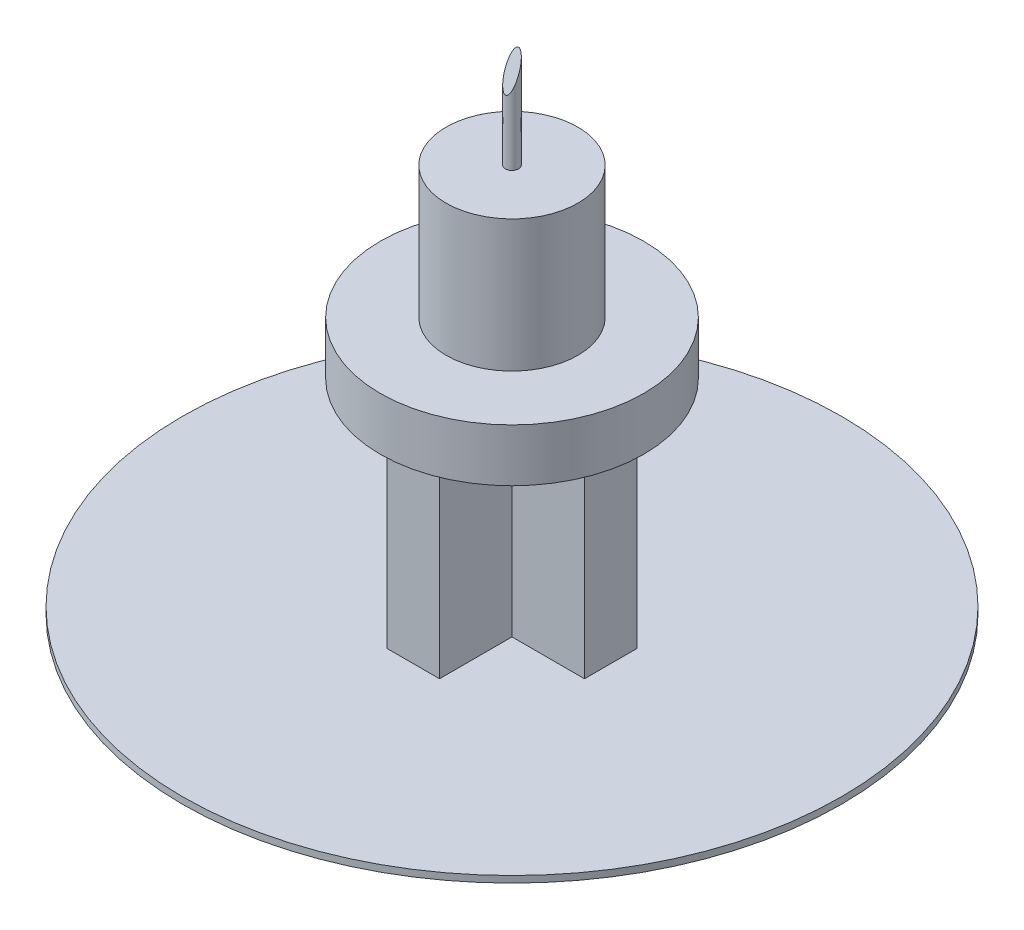
from build123d import *

# Parameters (mm, degrees)
SKETCH_1_R          = 10
EXTRUDE_1_DEPTH     = 0.2
EXTRUDE_2_DEPTH     = 6
SKETCH_3_R          = 4
EXTRUDE_3_DEPTH     = 1.6
SKETCH_4_R          = 7
EXTRUDE_4_DEPTH     = 0.22
SKETCH_5_R          = 2
EXTRUDE_5_DEPTH     = 4
SKETCH_6_R          = 0.2
EXTRUDE_6_DEPTH     = 3
CUT_EXTRUDE_1_DEPTH = 1.5


with BuildPart() as part:
    # 草图1 → 凸台-拉伸1 (new body)
    with BuildSketch(Plane(origin=(0, 0, 0), x_dir=(1, 0, 0), z_dir=(0, 1, 0))):
        with Locations(Location((0, 0, 0), (0, 0, 270))):
            Circle(SKETCH_1_R)
    extrude(amount=EXTRUDE_1_DEPTH)

    # 草图2 → 凸台-拉伸2 (add)
    with BuildSketch(Plane(origin=(0, 0.2, 0), x_dir=(1, 0, 0), z_dir=(0, 1, 0))):
        Polygon((-0.8, 3), (0.8, 3), (0.8, 0.8), (3, 0.8), (3, -0.8), (0.8, -0.8), (0.8, -3), (-0.8, -3), (-0.8, -0.8), (-3, -0.8), (-3, 0.8), (-0.8, 0.8), align=None)
    extrude(amount=EXTRUDE_2_DEPTH)

    # 草图3 → 凸台-拉伸3 (add)
    with BuildSketch(Plane(origin=(0, 6.2, 0), x_dir=(1, 0, 0), z_dir=(0, 1, 0))):
        with Locations(Location((0, 0, 0), (0, 0, 270))):
            Circle(SKETCH_3_R)
    extrude(amount=EXTRUDE_3_DEPTH)

    # 草图4 → 凸台-拉伸4 (add)
    with BuildSketch(Plane(origin=(0, 0, 0), x_dir=(-1, 0, 0), z_dir=(0, -1, 0))):
        with Locations(Location((0, 0, 0), (0, 0, 90))):
            Circle(SKETCH_4_R)
    extrude(amount=EXTRUDE_4_DEPTH)

    # 草图5 → 凸台-拉伸5 (add)
    with BuildSketch(Plane(origin=(0, 7.8, 0), x_dir=(1, 0, 0), z_dir=(0, 1, 0))):
        with Locations(Location((0, 0, 0), (0, 0, 270))):
            Circle(SKETCH_5_R)
    extrude(amount=EXTRUDE_5_DEPTH)

    # 草图6 → 凸台-拉伸6 (add)
    with BuildSketch(Plane(origin=(0, 11.8, 0), x_dir=(1, 0, 0), z_dir=(0, 1, 0))):
        with Locations(Location((0, 0, 0), (0, 0, 270))):
            Circle(SKETCH_6_R)
    extrude(amount=EXTRUDE_6_DEPTH)

    # 草图7 → 切除-拉伸1 (cut, symmetric)
    with BuildSketch(Plane(origin=(0, 0, 0), x_dir=(0, 0, -1), z_dir=(1, 0, 0))):
        Polygon((0.2, 14.8), (-0.2, 14.8), (-0.2, 13.740589274), align=None)
    extrude(amount=CUT_EXTRUDE_1_DEPTH, both=True, mode=Mode.SUBTRACT)


solid = part.part
